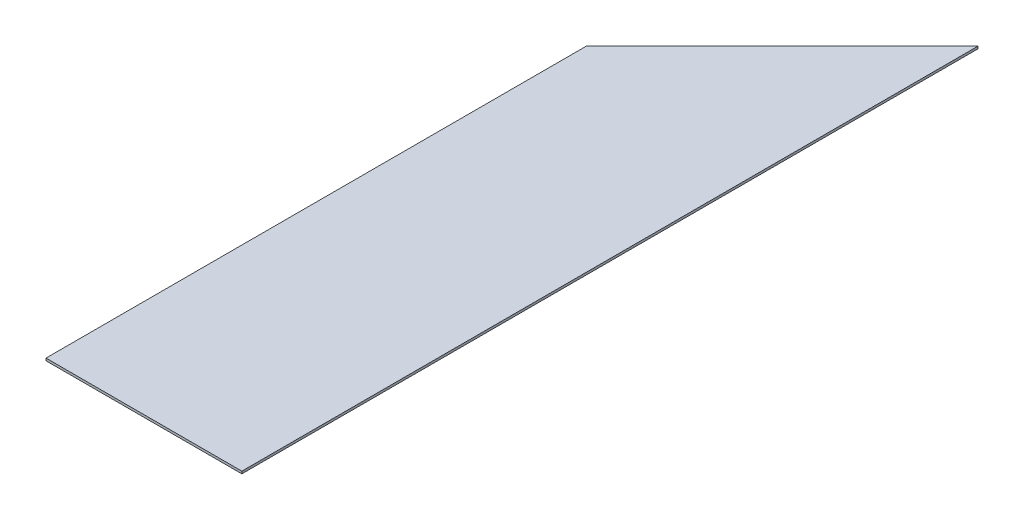
from build123d import *

# Parameters (mm, degrees)
BOSS_EXTRUDE1_DEPTH   = 327.5
BOSS_EXTRUDE1_2_DEPTH = 327.5
BOSS_EXTRUDE2_DEPTH   = 2
BOSS_EXTRUDE4_DEPTH   = 1
SKETCH4_W             = 100
SKETCH4_H             = 8.5
BOSS_EXTRUDE5_DEPTH   = 2
BOSS_EXTRUDE6_DEPTH   = 1
SKETCH7_R             = 5
SKETCH7_W             = 96
SKETCH7_H             = 1
CUT_EXTRUDE2_DEPTH    = 1
SKETCH8_W             = 100
SKETCH8_H             = 13.5
CUT_EXTRUDE3_DEPTH    = 400
SKETCH9_W             = 1
SKETCH9_H             = 5
CUT_EXTRUDE4_DEPTH    = 84.5
SKETCH10_W            = 83
SKETCH10_H            = 228.97918472
BOSS_EXTRUDE7_DEPTH   = 1
SKETCH12_W            = 120.619846079
SKETCH12_H            = 19.843524077
CUT_EXTRUDE6_DEPTH    = 400


with BuildPart() as part:
    # Sketch1 → Boss-Extrude1 (new body)
    with BuildSketch(Plane.XY):
        Polygon((0, 0), (0, 8.5), (1, 8.5), (1, 13.5), (2, 13.5), (2, 2), (13.5, 2), (13.5, 1), (8.5, 1), (8.5, 0), align=None)
    extrude(amount=BOSS_EXTRUDE1_DEPTH)



with BuildPart() as body_2:
    # Sketch1 → Boss-Extrude1 2 (new body)
    with BuildSketch(Plane.XY):
        Polygon((100, 0), (91.5, 0), (91.5, 1), (86.5, 1), (86.5, 2), (98, 2), (98, 13.5), (99, 13.5), (99, 8.5), (100, 8.5), align=None)
    extrude(amount=BOSS_EXTRUDE1_2_DEPTH)


with BuildPart() as part_1:
    add(part.part)

    add(body_2.part)  # Boss-Extrude2 merges body 2
    # Sketch2 → Boss-Extrude2 (add)
    with BuildSketch(Plane(origin=(0, 2, 0), x_dir=(1, 0, 0), z_dir=(0, 1, 0))):
        Polygon((86.5, 0), (13.5, -73), (13.5, -85.02081528), (86.5, -12.02081528), align=None)
    extrude(amount=-BOSS_EXTRUDE2_DEPTH)

    # Sketch3 → Boss-Extrude4 (add)
    with BuildSketch(Plane.XZ.offset(-1)):
        Polygon((13.5, 73), (13.5, 85.02081528), (8.5, 90.02081528), (8.5, 78), align=None)
        Polygon((86.5, 0), (86.5, 12.02081528), (91.5, 7.02081528), (91.5, 0), align=None)
    extrude(amount=BOSS_EXTRUDE4_DEPTH)

    # Sketch4 → Boss-Extrude5 (add)
    with BuildSketch(Plane.XZ):
        with Locations((50, 323.25)):
            Rectangle(SKETCH4_W, SKETCH4_H)
    extrude(amount=-BOSS_EXTRUDE5_DEPTH)

    # Sketch7 → Cut-Extrude2 (cut)
    with BuildSketch(Plane(origin=(0, 2, 0), x_dir=(1, 0, 0), z_dir=(0, 1, 0))):
        with Locations((26.5, -326.5)):
            Circle(SKETCH7_R)
        with Locations((73.5, -326.5)):
            Circle(SKETCH7_R)
        with Locations((50, -327)):
            Rectangle(SKETCH7_W, SKETCH7_H)
    extrude(amount=-CUT_EXTRUDE2_DEPTH, mode=Mode.SUBTRACT)


with BuildPart() as body_2_2:
    # Sketch5 → Boss-Extrude6 (new body)
    with BuildSketch(Plane(origin=(0, 2, 0), x_dir=(1, 0, 0), z_dir=(0, 1, 0))):
        Polygon((13.5, -65.928932188), (79.428932188, 0), (86.5, 0), (13.5, -73), align=None)
    extrude(amount=-BOSS_EXTRUDE6_DEPTH)


with BuildPart() as body_3:
    # Mirror1: mirrored copy
    add(body_2_2.part.mirror(Plane(origin=(1, 13.5, 327.5), x_dir=(0, 0, 1), z_dir=(0, -1, 0))))


with BuildPart() as body_4:
    # Mirror1 2: mirrored copy
    add(part_1.part.mirror(Plane(origin=(1, 13.5, 327.5), x_dir=(0, 0, 1), z_dir=(0, -1, 0))))

    # Sketch9 → Cut-Extrude4 (cut)
    with BuildSketch(Plane(origin=(0, 0, 0), x_dir=(-1, 0, 0), z_dir=(0, 0, -1))):
        with Locations((-1.5, 16)):
            Rectangle(SKETCH9_W, SKETCH9_H)
    extrude(amount=-CUT_EXTRUDE4_DEPTH, mode=Mode.SUBTRACT)


with BuildPart() as cut_extrude3_tool:
    # Sketch8 → Cut-Extrude3 (new body)
    with BuildSketch(Plane(origin=(0, 0, 0), x_dir=(-1, 0, 0), z_dir=(0, 0, -1))):
        with Locations((-50, 6.75)):
            Rectangle(SKETCH8_W, SKETCH8_H)
    extrude(amount=-CUT_EXTRUDE3_DEPTH)


with BuildPart() as part_2:
    add(part_1.part)

    # Cut-Extrude3: cut by cut_extrude3_tool
    add(cut_extrude3_tool.part, mode=Mode.SUBTRACT)


with BuildPart() as body_2_2_1:
    add(body_2_2.part)

    # Cut-Extrude3: cut by cut_extrude3_tool
    add(cut_extrude3_tool.part, mode=Mode.SUBTRACT)


with BuildPart() as body_3_2:
    # Sketch10 → Boss-Extrude7 (new body)
    with BuildSketch(Plane(origin=(0, 27, 0), x_dir=(1, 0, 0), z_dir=(0, 1, 0))):
        Polygon((91.5, -7.02081528), (8.5, -90.02081528), (91.5, -90.02081528), align=None)
        with Locations((50, -204.51040764)):
            Rectangle(SKETCH10_W, SKETCH10_H)
    extrude(amount=BOSS_EXTRUDE7_DEPTH)


with BuildPart() as cut_extrude6_tool:
    # Sketch12 → Cut-Extrude6 (new body)
    with BuildSketch(Plane.XY.offset(327.5)):
        with Locations((60.30992304, 17.078237962)):
            Rectangle(SKETCH12_W, SKETCH12_H)
    extrude(amount=-CUT_EXTRUDE6_DEPTH)


with BuildPart() as body_3_1:
    add(body_3.part)

    # Cut-Extrude6: cut by cut_extrude6_tool
    add(cut_extrude6_tool.part, mode=Mode.SUBTRACT)


with BuildPart() as body_4_1:
    add(body_4.part)

    # Cut-Extrude6: cut by cut_extrude6_tool
    add(cut_extrude6_tool.part, mode=Mode.SUBTRACT)


solid = body_3_2.part
